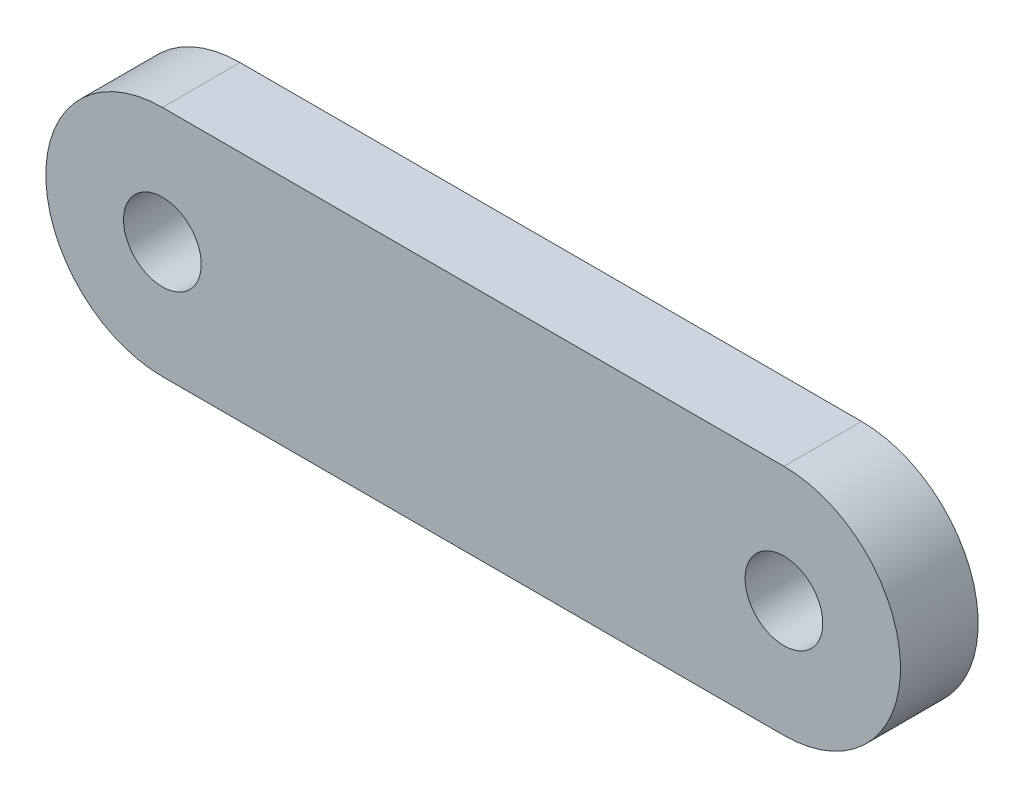
from build123d import *

# Parameters (mm, degrees)
SKETCH1_R           = 4.7625
SKETCH1_R_2         = 1.5875
BOSS_EXTRUDE1_DEPTH = 3.175


with BuildPart() as part:
    # Sketch1 → Boss-Extrude1 (new body)
    # profile 1 of 3: a face of its own
    with BuildSketch(Plane.XY):
        with BuildLine():
            Line((25.4, 4.7625), (0, 4.7625))
            ThreePointArc((0, 4.7625), (3.367596045, 3.367596045), (4.7625, 0))
            ThreePointArc((4.7625, 0), (3.367596045, -3.367596045), (0, -4.7625))
            Line((0, -4.7625), (25.4, -4.7625))
            ThreePointArc((25.4, -4.7625), (20.6375, 0), (25.4, 4.7625))
        make_face()
    # profile 2 of 3: a face of its own
    with BuildSketch(Plane.XY):
        Circle(SKETCH1_R)
        with Locations(Location((0, 0, 0), (0, 0, 180))):
            Circle(SKETCH1_R_2, mode=Mode.SUBTRACT)
    # profile 3 of 3: a face of its own
    with BuildSketch(Plane.XY):
        with Locations((25.4, 0)):
            Circle(SKETCH1_R)
        with Locations(Location((25.4, 0, 0), (0, 0, 180))):
            Circle(SKETCH1_R_2, mode=Mode.SUBTRACT)
    extrude(amount=BOSS_EXTRUDE1_DEPTH)


solid = part.part
